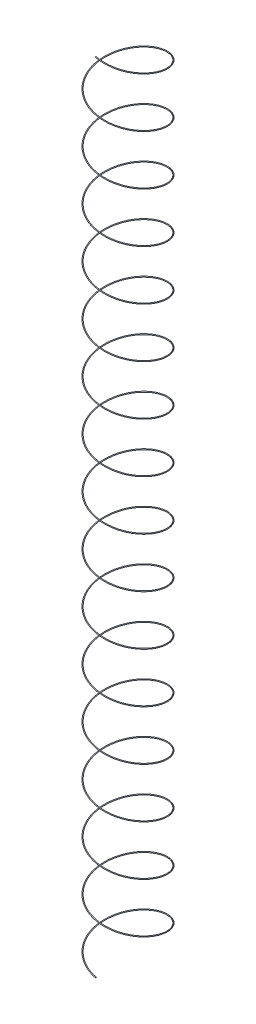
from build123d import *

# Parameters (mm, degrees)
SWEEP1_PITCH  = 31.25
SWEEP1_HEIGHT = 500
SWEEP1_RADIUS = 20.15
SKETCH2_R     = 0.25


with BuildPart() as part:
    # Sweep1: sweep along a helix
    with BuildLine() as sweep1_path:
        Helix(SWEEP1_PITCH, SWEEP1_HEIGHT, SWEEP1_RADIUS, center=(0, 0, 0), direction=(0, 1, 0), lefthand=True)
    # Sketch2 → Sweep1 (sweep)
    with BuildSketch(Plane(origin=(0, 0, 0), x_dir=(0, 0, -1), z_dir=(1, 0, 0))):
        with Locations((-20.15, 0)):
            Circle(SKETCH2_R)
    sweep(path=sweep1_path.line, is_frenet=True)


solid = part.part
